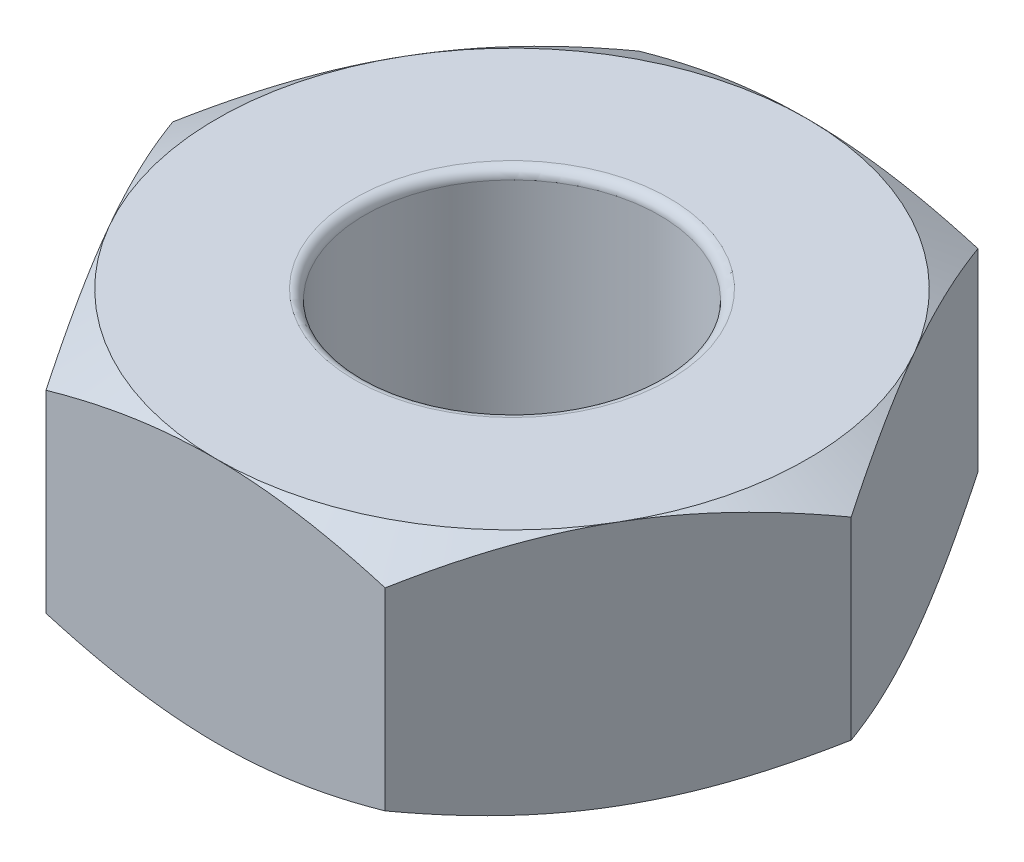
from build123d import *

# Parameters (mm, degrees)
SKETCH1_R           = 0.75
BOSS_EXTRUDE1_DEPTH = 1.25
SKETCH2_OUTSIDE_W   = 9.88
SKETCH2_OUTSIDE_H   = 9.424
SKETCH2_OUTSIDE_R   = 1.5
CUT_EXTRUDE2_DEPTH  = 1
CUT_EXTRUDE2_DRAFT  = -60
SKETCH3_OUTSIDE_W   = 9.88
SKETCH3_OUTSIDE_H   = 9.424
SKETCH3_OUTSIDE_R   = 1.5
CUT_EXTRUDE3_DEPTH  = 1
CUT_EXTRUDE3_DRAFT  = -60
FILLET1_R           = 0.05


with BuildPart() as part:
    # Sketch1 → Boss-Extrude1 (new body)
    with BuildSketch(Plane(origin=(0, 0, 0), x_dir=(1, 0, 0), z_dir=(0, 1, 0))):
        Polygon((0.872862718, 1.496031643), (-0.859170049, 1.503937109), (-1.732032766, 0.007905466), (-0.872862718, -1.496031643), (0.859170049, -1.503937109), (1.732032766, -0.007905466), align=None)
        with Locations(Location((0, 0, 0), (0, 0, 270))):
            Circle(SKETCH1_R, mode=Mode.SUBTRACT)
    extrude(amount=BOSS_EXTRUDE1_DEPTH)


with BuildPart() as cut_extrude2_tool:
    # Sketch2 outside → Cut-Extrude2 (with draft: the straight prism first)
    with BuildSketch(Plane(origin=(0, 1.25, 0), x_dir=(1, 0, 0), z_dir=(0, 1, 0))):
        Rectangle(SKETCH2_OUTSIDE_W, SKETCH2_OUTSIDE_H)
        Circle(SKETCH2_OUTSIDE_R, mode=Mode.SUBTRACT)
    extrude(amount=-CUT_EXTRUDE2_DEPTH)
    # Cut-Extrude2: the draft: its side faces are tilted about the plane it starts from
    cut_extrude2_sides = [cut_extrude2_tool.faces().sort_by_distance(p)[0] for p in [
        (0, 0.75, 4.712),
        (4.94, 0.75, 0),
        (0, 0.75, -4.712),
        (-4.94, 0.75, 0),
        (-1.5, 0.75, 0),
    ]]
    draft(cut_extrude2_sides, Plane(origin=(0, 1.25, 0), x_dir=(1, 0, 0), z_dir=(0, 1, 0)), CUT_EXTRUDE2_DRAFT)


with BuildPart() as part_1:
    add(part.part)

    # Cut-Extrude2: cut by cut_extrude2_tool
    add(cut_extrude2_tool.part, mode=Mode.SUBTRACT)


with BuildPart() as cut_extrude3_tool:
    # Sketch3 outside → Cut-Extrude3 (with draft: the straight prism first)
    with BuildSketch(Plane.XZ):
        Rectangle(SKETCH3_OUTSIDE_W, SKETCH3_OUTSIDE_H)
        Circle(SKETCH3_OUTSIDE_R, mode=Mode.SUBTRACT)
    extrude(amount=-CUT_EXTRUDE3_DEPTH)
    # Cut-Extrude3: the draft: its side faces are tilted about the plane it starts from
    cut_extrude3_sides = [cut_extrude3_tool.faces().sort_by_distance(p)[0] for p in [
        (0, 0.5, -4.712),
        (4.94, 0.5, 0),
        (0, 0.5, 4.712),
        (-4.94, 0.5, 0),
        (-1.5, 0.5, 0),
    ]]
    draft(cut_extrude3_sides, Plane.XZ, CUT_EXTRUDE3_DRAFT)


with BuildPart() as part_2:
    add(part_1.part)

    # Cut-Extrude3: cut by cut_extrude3_tool
    add(cut_extrude3_tool.part, mode=Mode.SUBTRACT)

    # Fillet1
    fillet1_edges = [part_2.edges().sort_by_distance(p)[0] for p in [
        (0, 0, -0.75),
        (0, 1.25, -0.75),
    ]]
    fillet(fillet1_edges, radius=FILLET1_R)


solid = part_2.part
